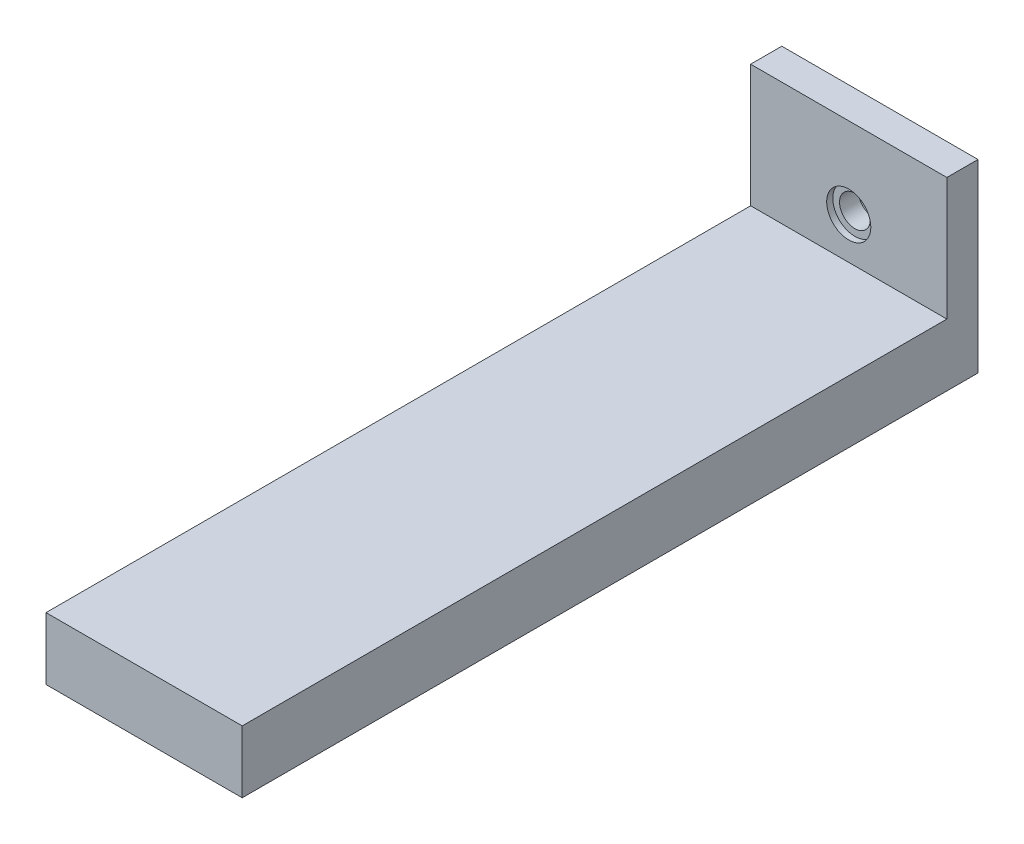
from build123d import *

# Parameters (mm, degrees)
CROQUIS1_W              = 160
CROQUIS1_H              = 50.8
SALIENTE_EXTRUIR1_DEPTH = 300
CROQUIS2_W              = 160
CROQUIS2_H              = 25.4
SALIENTE_EXTRUIR2_DEPTH = 100
CROQUIS3_R              = 12.5
CORTAR_EXTRUIR1_DEPTH   = 100
CROQUIS4_R              = 18
CORTAR_EXTRUIR2_DEPTH   = 5
CORTAR_EXTRUIR3_START   = -5
CROQUIS5_R              = 18
CORTAR_EXTRUIR3_DEPTH   = 5


with BuildPart() as part:
    # Croquis1 → Saliente-Extruir1 (new, symmetric)
    with BuildSketch(Plane.XY):
        Rectangle(CROQUIS1_W, CROQUIS1_H)
    extrude(amount=SALIENTE_EXTRUIR1_DEPTH, both=True)

    # Croquis2 → Saliente-Extruir2 (add)
    with BuildSketch(Plane(origin=(0, 25.4, 0), x_dir=(1, 0, 0), z_dir=(0, 1, 0))):
        with Locations((0, 287.3)):
            Rectangle(CROQUIS2_W, CROQUIS2_H)
    extrude(amount=SALIENTE_EXTRUIR2_DEPTH)

    # Croquis3 → Cortar-Extruir1 (cut)
    with BuildSketch(Plane.XY.offset(-274.6)):
        with Locations((0, 59.234859244)):
            Circle(CROQUIS3_R)
    extrude(amount=-CORTAR_EXTRUIR1_DEPTH, mode=Mode.SUBTRACT)

    # Croquis4 → Cortar-Extruir2 (cut)
    with BuildSketch(Plane.XY.offset(-274.6)):
        with Locations((0, 59.234859244)):
            Circle(CROQUIS4_R)
    extrude(amount=-CORTAR_EXTRUIR2_DEPTH, mode=Mode.SUBTRACT)

    # Croquis5 → Cortar-Extruir3 (cut)
    with BuildSketch(Plane(origin=(0, 0, -300), x_dir=(-1, 0, 0), z_dir=(0, 0, -1)).offset(CORTAR_EXTRUIR3_START)):
        with Locations(Location((0, 59.234859244, 0), (0, 0, 180))):
            Circle(CROQUIS5_R)
    extrude(amount=CORTAR_EXTRUIR3_DEPTH, mode=Mode.SUBTRACT)


solid = part.part
